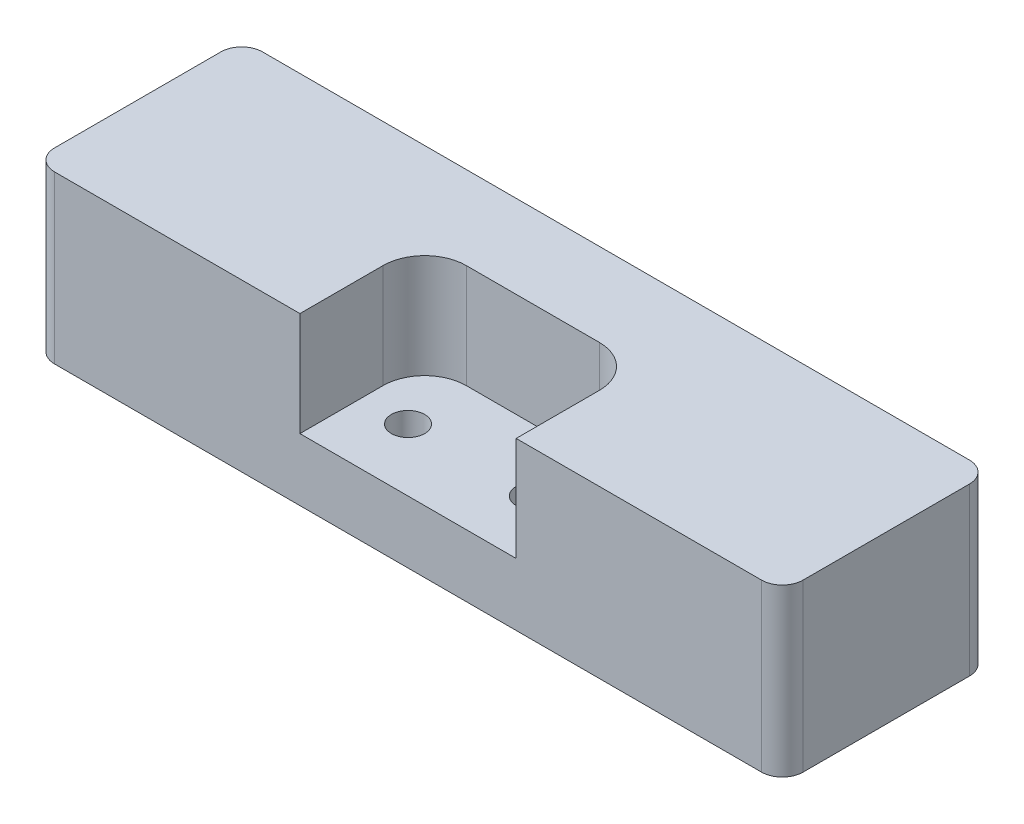
from build123d import *

# Parameters (mm, degrees)
ESBO_O2_W                                  = 36
ESBO_O2_H                                  = 10
RESSALTO_EXTRUS_O2_DEPTH                   = 8
FILETE3_R                                  = 1
ESBO_O5_W                                  = 10.4
ESBO_O5_H                                  = 6
CORTE_EXTRUS_O1_DEPTH                      = 5
FILETE4_R                                  = 2
BROCA_DE_ROSQUEAR_PARA_TARRAXA_DE_M2X0_4_D = 1.6


with BuildPart() as part:
    # Esboço2 → Ressalto-extrusão2 (new body)
    with BuildSketch(Plane(origin=(0, 0, 0), x_dir=(1, 0, 0), z_dir=(0, 1, 0))):
        with Locations((15, 5)):
            Rectangle(ESBO_O2_W, ESBO_O2_H)
    extrude(amount=RESSALTO_EXTRUS_O2_DEPTH)

    # Filete3
    filete3_edges = [part.edges().sort_by_distance(p)[0] for p in [
        (33, 4, 0),
        (-3, 4, 0),
        (-3, 4, -10),
        (33, 4, -10),
    ]]
    fillet(filete3_edges, radius=FILETE3_R)

    # Esboço5 → Corte-extrusão1 (cut)
    with BuildSketch(Plane(origin=(0, 8, 0), x_dir=(1, 0, 0), z_dir=(0, 1, 0))):
        with Locations((15, 3)):
            Rectangle(ESBO_O5_W, ESBO_O5_H)
    extrude(amount=-CORTE_EXTRUS_O1_DEPTH, mode=Mode.SUBTRACT)

    # Filete4
    filete4_edges = [part.edges().sort_by_distance(p)[0] for p in [
        (20.2, 5.5, -6),
        (9.8, 5.5, -6),
    ]]
    fillet(filete4_edges, radius=FILETE4_R)

    # Broca de rosquear para tarraxa de M2x0.41 (through all)
    with Locations(Plane(origin=(12, 3, -3), x_dir=(0, 0, 1), z_dir=(0, 1, 0))):
        with Locations((0, 0), (0, 6)):
            Hole(BROCA_DE_ROSQUEAR_PARA_TARRAXA_DE_M2X0_4_D / 2)


solid = part.part
